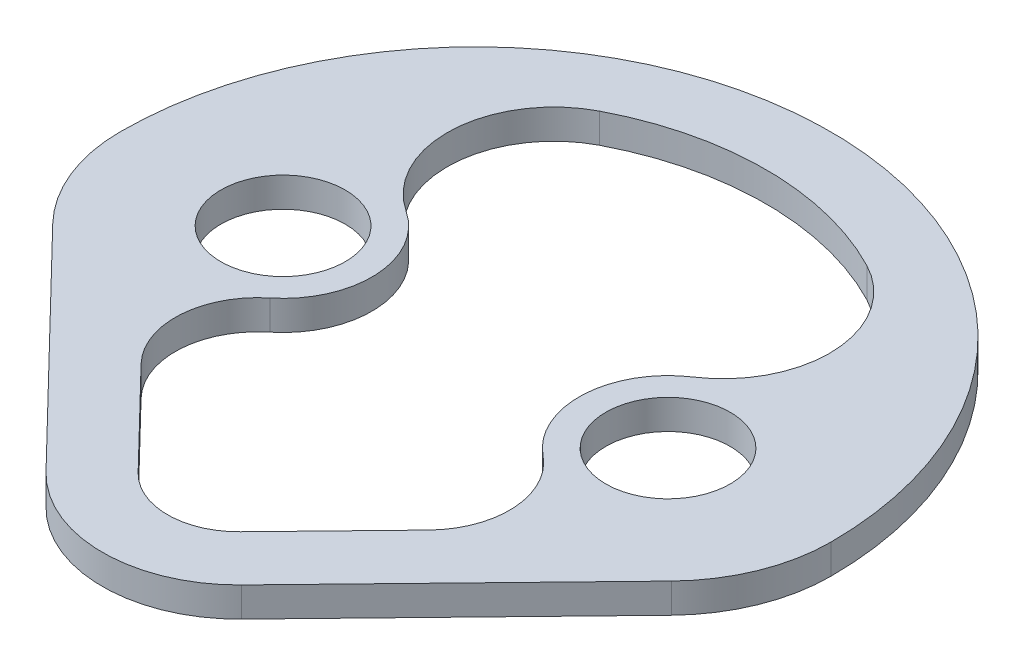
from build123d import *

# Parameters (mm, degrees)
SKETCH1_R           = 10.5
BOSS_EXTRUDE2_DEPTH = 5


with BuildPart() as part:
    # Sketch1 → Boss-Extrude2 (new body)
    with BuildSketch(Plane(origin=(0, 0, 0), x_dir=(1, 0, 0), z_dir=(0, 1, 0))):
        with BuildLine():
            Line((16.516096513, -16.006828417), (52.2475067, 20.861400806))
            ThreePointArc((52.2475067, 20.861400806), (57.988295689, 29.675428199), (60, 40))
            ThreePointArc((60, 40), (42.426406871, 82.426406871), (0, 100))
            ThreePointArc((0, 100), (-42.426406871, 82.426406871), (-60, 40))
            ThreePointArc((-60, 40), (-57.988295689, 29.675428199), (-52.2475067, 20.861400806))
            Line((-52.2475067, 20.861400806), (-16.516096513, -16.006828417))
            ThreePointArc((-16.516096513, -16.006828417), (-8.967802028, -21.17967249), (0, -23))
            ThreePointArc((0, -23), (8.967802028, -21.17967249), (16.516096513, -16.006828417))
        make_face()
        with Locations(Location((32.5, 40, 0), (0, 0, 270))):
            Circle(SKETCH1_R, mode=Mode.SUBTRACT)
        with Locations(Location((-32.5, 40, 0), (0, 0, 90))):
            Circle(SKETCH1_R, mode=Mode.SUBTRACT)
        with BuildLine():
            Line((8.617093833, -8.351388739), (24.288887892, 7.819014071))
            ThreePointArc((24.288887892, 7.819014071), (28.192805121, 18.354250949), (23.055780503, 28.34638605))
            ThreePointArc((23.055780503, 28.34638605), (17.517341086, 40.721063014), (24.218531469, 52.506689369))
            ThreePointArc((24.218531469, 52.506689369), (32.255432897, 68.469423949), (22.572828784, 83.491003675))
            ThreePointArc((22.572828784, 83.491003675), (0, 89), (-22.572828784, 83.491003675))
            ThreePointArc((-22.572828784, 83.491003675), (-32.255432897, 68.469423949), (-24.218531469, 52.506689369))
            ThreePointArc((-24.218531469, 52.506689369), (-17.517341086, 40.721063014), (-23.055780503, 28.34638605))
            ThreePointArc((-23.055780503, 28.34638605), (-28.192805121, 18.354250949), (-24.288887892, 7.819014071))
            Line((-24.288887892, 7.819014071), (-8.617093833, -8.351388739))
            ThreePointArc((-8.617093833, -8.351388739), (-4.678853232, -11.050263908), (0, -12))
            ThreePointArc((0, -12), (4.678853232, -11.050263908), (8.617093833, -8.351388739))
        make_face(mode=Mode.SUBTRACT)
    extrude(amount=BOSS_EXTRUDE2_DEPTH)


solid = part.part
